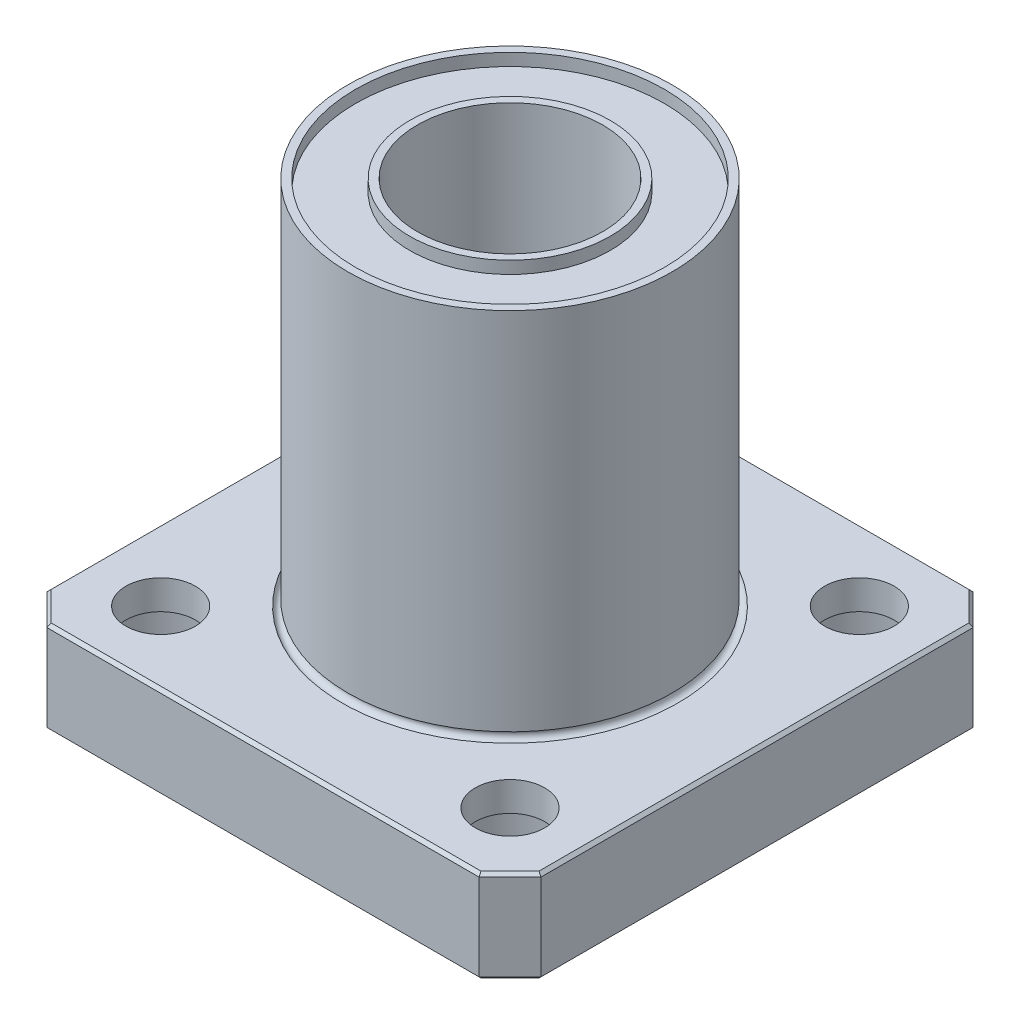
from build123d import *

# Parameters (mm, degrees)
FLANGE_START         = 6
FLANGE_DEPTH         = 6
SKETCH9_R            = 4
COUNTERBORE_DEPTH    = 4.1
SKETCH10_R           = 2.25
MOUNTING_HOLES_DEPTH = 35.392004885
SKETCH11_R           = 0.375
CHAMFER1_SIZE        = 0.2


with BuildPart() as part:
    # Sketch5 → Bearing Body (revolve)
    with BuildSketch(Plane(origin=(0, 0, 0), x_dir=(0, 0, -1), z_dir=(1, 0, 0))):
        Polygon((6.5, 30), (6, 30), (6, 0), (6.5, 0), (6.5, 0.8), (10, 0.8), (10, 0), (10.5, 0), (10.5, 30), (10, 30), (10, 29.2), (6.5, 29.2), align=None)
    revolve(axis=Axis((0, 0, 0), (0, 1, 0)))

    # Sketch8 → Flange (add)
    with BuildSketch(Plane(origin=(0, 0, 0), x_dir=(1, 0, 0), z_dir=(0, 1, 0)).offset(FLANGE_START)):
        Polygon((0, -16), (-14, -16), (-16, -14), (-16, 0), (-16, 14), (-14, 16), (0, 16), (14, 16), (16, 14), (16, 0), (16, -14), (14, -16), align=None)
        with BuildLine():
            ThreePointArc((-10.5, 0), (-7.424621202, -7.424621202), (0, -10.5))
            ThreePointArc((0, -10.5), (7.424621202, -7.424621202), (10.5, 0))
            ThreePointArc((10.5, 0), (7.424621202, 7.424621202), (0, 10.5))
            ThreePointArc((0, 10.5), (-7.424621202, 7.424621202), (-10.5, 0))
        make_face(mode=Mode.SUBTRACT)
    extrude(amount=-FLANGE_DEPTH)

    # Sketch9 → Counterbore (cut)
    with BuildSketch(Plane(origin=(0, 0, 0), x_dir=(-1, 0, 0), z_dir=(0, -1, 0))):
        with Locations(Location((11.313708499, -11.313708499, 0), (0, 0, 90))):
            Circle(SKETCH9_R)
        with Locations(Location((-11.313708499, -11.313708499, 0), (0, 0, 90))):
            Circle(SKETCH9_R)
        with Locations(Location((-11.313708499, 11.313708499, 0), (0, 0, 90))):
            Circle(SKETCH9_R)
        with Locations(Location((11.313708499, 11.313708499, 0), (0, 0, 90))):
            Circle(SKETCH9_R)
    extrude(amount=-COUNTERBORE_DEPTH, mode=Mode.SUBTRACT)

    # Sketch10 → Mounting Holes (cut, through all)
    with BuildSketch(Plane(origin=(0, 4.1, 0), x_dir=(-1, 0, 0), z_dir=(0, -1, 0))):
        with Locations(Location((11.313708499, 11.313708499, 0), (0, 0, 90))):
            Circle(SKETCH10_R)
        with Locations(Location((11.313708499, -11.313708499, 0), (0, 0, 90))):
            Circle(SKETCH10_R)
        with Locations(Location((-11.313708499, -11.313708499, 0), (0, 0, 90))):
            Circle(SKETCH10_R)
        with Locations(Location((-11.313708499, 11.313708499, 0), (0, 0, 90))):
            Circle(SKETCH10_R)
    extrude(amount=-MOUNTING_HOLES_DEPTH, mode=Mode.SUBTRACT)

    # Sketch11 → Relief (revolve, cut)
    with BuildSketch(Plane(origin=(0, 0, 0), x_dir=(0, 0, -1), z_dir=(1, 0, 0)), mode=Mode.PRIVATE) as relief_sk:
        with Locations((-10.5, 6)):
            Circle(SKETCH11_R)
    revolve(relief_sk.sketch.rotate(Axis((0, 0, 0), (0, 1, 0)), 180), axis=Axis((0, 0, 0), (0, 1, 0)), mode=Mode.SUBTRACT)

    # Chamfer1
    chamfer1_edges = [part.edges().sort_by_distance(p)[0] for p in [
        (-15, 6, 15),
        (0, 6, 16),
        (15, 6, 15),
        (16, 6, 0),
        (15, 6, -15),
        (0, 6, -16),
        (-15, 6, -15),
        (-16, 6, 0),
        (-15, 0, 15),
        (0, 0, 16),
        (15, 0, 15),
        (16, 0, 0),
        (15, 0, -15),
        (0, 0, -16),
        (-15, 0, -15),
        (-16, 0, 0),
    ]]
    chamfer(chamfer1_edges, length=CHAMFER1_SIZE)


solid = part.part
